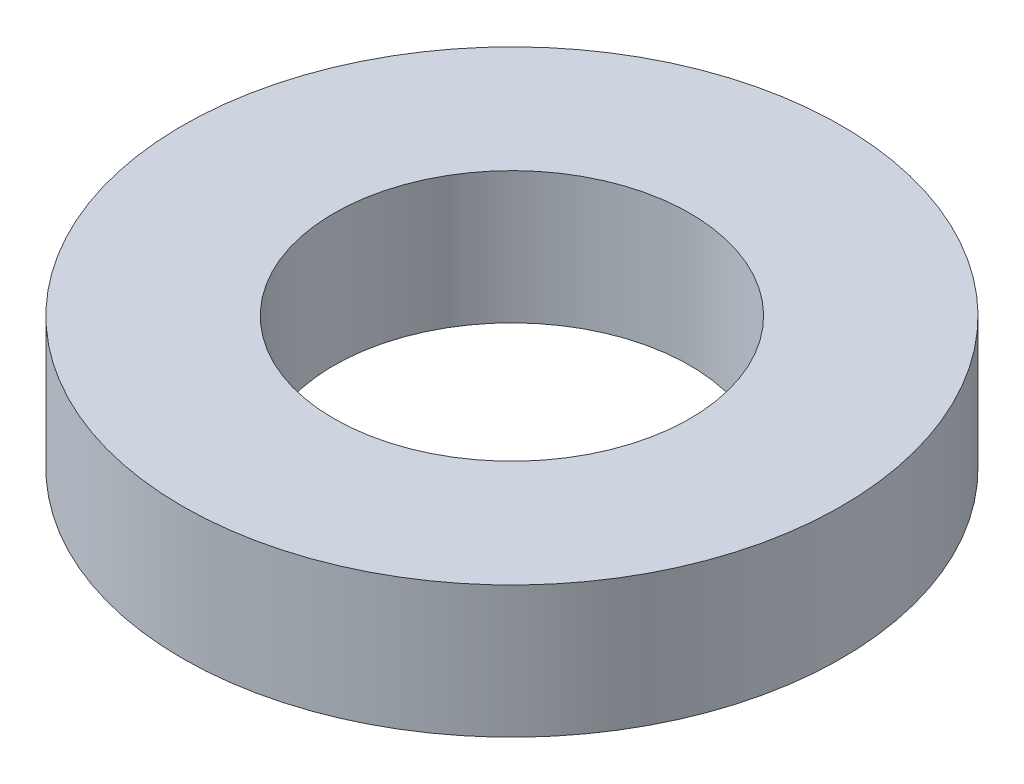
from build123d import *

# Parameters (mm, degrees)
SKETCH1_R           = 5
SKETCH1_R_2         = 2.7
BOSS_EXTRUDE1_DEPTH = 2


with BuildPart() as part:
    # Sketch1 → Boss-Extrude1 (new body)
    with BuildSketch(Plane(origin=(0, 0, 0), x_dir=(1, 0, 0), z_dir=(0, 1, 0))):
        with Locations(Location((0, 0, 0), (0, 0, 270))):
            Circle(SKETCH1_R)
        with Locations(Location((0, 0, 0), (0, 0, 270))):
            Circle(SKETCH1_R_2, mode=Mode.SUBTRACT)
    extrude(amount=BOSS_EXTRUDE1_DEPTH)


solid = part.part
